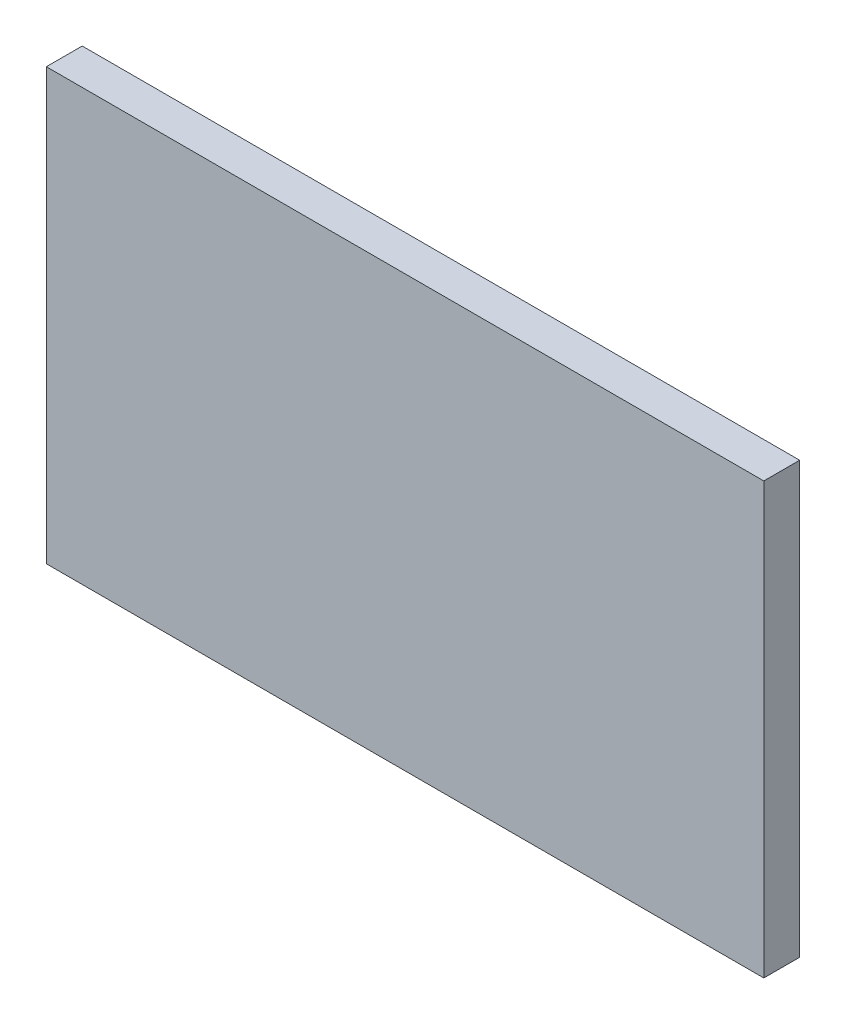
from build123d import *

# Parameters (mm, degrees)
SKETCH_1_W      = 200
SKETCH_1_H      = 120
EXTRUDE_1_DEPTH = 10


with BuildPart() as part:
    # Эскиз1 → Бобышка-Вытянуть1 (new body)
    with BuildSketch(Plane.XY):
        Rectangle(SKETCH_1_W, SKETCH_1_H)
    extrude(amount=EXTRUDE_1_DEPTH)


solid = part.part
